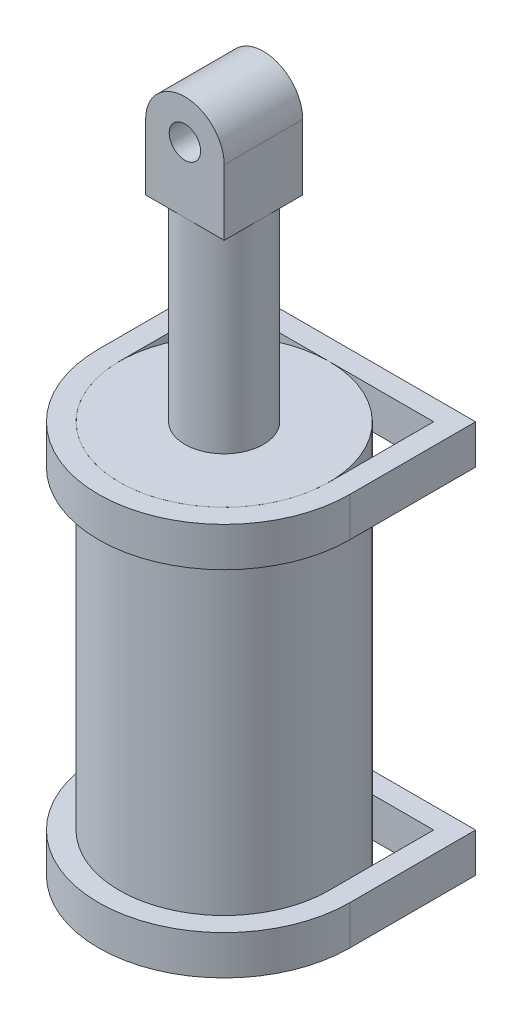
from build123d import *

# Parameters (mm, degrees)
SKETCH1_R               = 40
BOSS_EXTRUDE1_DEPTH     = 75
SKETCH2_R               = 15
BOSS_EXTRUDE2_DEPTH     = 75
SKETCH3_W               = 30
SKETCH3_H               = 30
BOSS_EXTRUDE3_DEPTH     = 25
BOSS_EXTRUDE4_DEPTH     = 30
CUT_EXTRUDE1_DEPTH      = 202.804360706
CUT_EXTRUDE1_DEPTH_BACK = 202.804360706
SKETCH5_R               = 6
BOSS_EXTRUDE6_DEPTH     = 15
BOSS_EXTRUDE8_DEPTH     = 15
SKETCH8_W               = 10
SKETCH8_H               = 15
CUT_EXTRUDE2_DEPTH      = 10
SKETCH9_W               = 10
SKETCH9_H               = 15
CUT_EXTRUDE3_DEPTH      = 10
SKETCH10_W              = 10
SKETCH10_H              = 15
CUT_EXTRUDE4_DEPTH      = 10
SKETCH11_W              = 10
SKETCH11_H              = 15
CUT_EXTRUDE5_DEPTH      = 10


with BuildPart() as part:
    # Sketch1 → Boss-Extrude1 (new, symmetric)
    with BuildSketch(Plane(origin=(0, 0, 0), x_dir=(1, 0, 0), z_dir=(0, 1, 0))):
        with Locations(Location((0, 0, 0), (0, 0, 270))):
            Circle(SKETCH1_R)
    extrude(amount=BOSS_EXTRUDE1_DEPTH, both=True)

    # Sketch2 → Boss-Extrude2 (add)
    with BuildSketch(Plane(origin=(0, 75, 0), x_dir=(1, 0, 0), z_dir=(0, 1, 0))):
        with Locations(Location((0, 0, 0), (0, 0, 270))):
            Circle(SKETCH2_R)
    extrude(amount=BOSS_EXTRUDE2_DEPTH)

    # Sketch3 → Boss-Extrude3 (add)
    with BuildSketch(Plane(origin=(0, 150, 0), x_dir=(1, 0, 0), z_dir=(0, 1, 0))):
        Rectangle(SKETCH3_W, SKETCH3_H)
    extrude(amount=BOSS_EXTRUDE3_DEPTH)

    # Sketch4 → Boss-Extrude4 (add)
    with BuildSketch(Plane.XY.offset(15)):
        with BuildLine():
            Line((-15, 175), (15, 175))
            ThreePointArc((15, 175), (0, 190), (-15, 175))
        make_face()
    extrude(amount=-BOSS_EXTRUDE4_DEPTH)

    # Sketch5 → Cut-Extrude1 (cut, two sides: drawn at the far end of the back side and taken through both)
    with BuildSketch(Plane.XY.offset(15).offset(-CUT_EXTRUDE1_DEPTH_BACK)):
        with Locations((0, 175)):
            Circle(SKETCH5_R)
    extrude(amount=CUT_EXTRUDE1_DEPTH + CUT_EXTRUDE1_DEPTH_BACK, mode=Mode.SUBTRACT)


with BuildPart() as body_2:
    # Sketch6 → Boss-Extrude6 (new body)
    with BuildSketch(Plane.XZ.offset(75)):
        with BuildLine():
            Line((-48, 0), (-48, -40))
            Line((-48, -40), (-48, -58))
            Line((-48, -58), (-40, -58))
            Line((-40, -58), (-40, -48))
            Line((-40, -48), (0, -48))
            Line((0, -48), (40, -48))
            Line((40, -48), (58, -48))
            Line((58, -48), (58, -40))
            Line((58, -40), (48, -40))
            Line((48, -40), (48, 0))
            ThreePointArc((48, 0), (0, 48), (-48, 0))
        make_face()
        with BuildLine():
            Line((-40, 0), (-40, -40))
            Line((-40, -40), (40, -40))
            Line((40, -40), (40, 0))
            ThreePointArc((40, 0), (0, 40), (-40, 0))
        make_face(mode=Mode.SUBTRACT)
    extrude(amount=-BOSS_EXTRUDE6_DEPTH)

    # Sketch8 → Cut-Extrude2 (cut)
    with BuildSketch(Plane(origin=(-40, 0, 0), x_dir=(0, 0, -1), z_dir=(1, 0, 0))):
        with Locations((53, -67.5)):
            Rectangle(SKETCH8_W, SKETCH8_H)
    extrude(amount=-CUT_EXTRUDE2_DEPTH, mode=Mode.SUBTRACT)

    # Sketch11 → Cut-Extrude5 (cut)
    with BuildSketch(Plane.XY.offset(-40)):
        with Locations((53, -67.5)):
            Rectangle(SKETCH11_W, SKETCH11_H)
    extrude(amount=-CUT_EXTRUDE5_DEPTH, mode=Mode.SUBTRACT)


with BuildPart() as body_3:
    # Sketch7 → Boss-Extrude8 (new body)
    with BuildSketch(Plane(origin=(0, 75, 0), x_dir=(1, 0, 0), z_dir=(0, 1, 0))):
        with BuildLine():
            Line((48, 40), (58, 40))
            Line((58, 40), (58, 48))
            Line((58, 48), (-40, 48))
            Line((-40, 48), (-40, 58))
            Line((-40, 58), (-48, 58))
            Line((-48, 58), (-48, 0))
            ThreePointArc((-48, 0), (0, -48), (48, 0))
            Line((48, 0), (48, 40))
        make_face()
        with BuildLine():
            Line((40, 40), (40, 0))
            ThreePointArc((40, 0), (0, -40), (-40, 0))
            Line((-40, 0), (-40, 40))
            Line((-40, 40), (40, 40))
        make_face(mode=Mode.SUBTRACT)
    extrude(amount=-BOSS_EXTRUDE8_DEPTH)

    # Sketch9 → Cut-Extrude3 (cut)
    with BuildSketch(Plane(origin=(-40, 0, 0), x_dir=(0, 0, -1), z_dir=(1, 0, 0))):
        with Locations((53, 67.5)):
            Rectangle(SKETCH9_W, SKETCH9_H)
    extrude(amount=-CUT_EXTRUDE3_DEPTH, mode=Mode.SUBTRACT)

    # Sketch10 → Cut-Extrude4 (cut)
    with BuildSketch(Plane.XY.offset(-40)):
        with Locations((53, 67.5)):
            Rectangle(SKETCH10_W, SKETCH10_H)
    extrude(amount=-CUT_EXTRUDE4_DEPTH, mode=Mode.SUBTRACT)


solid = Compound([part.part, body_2.part, body_3.part])
